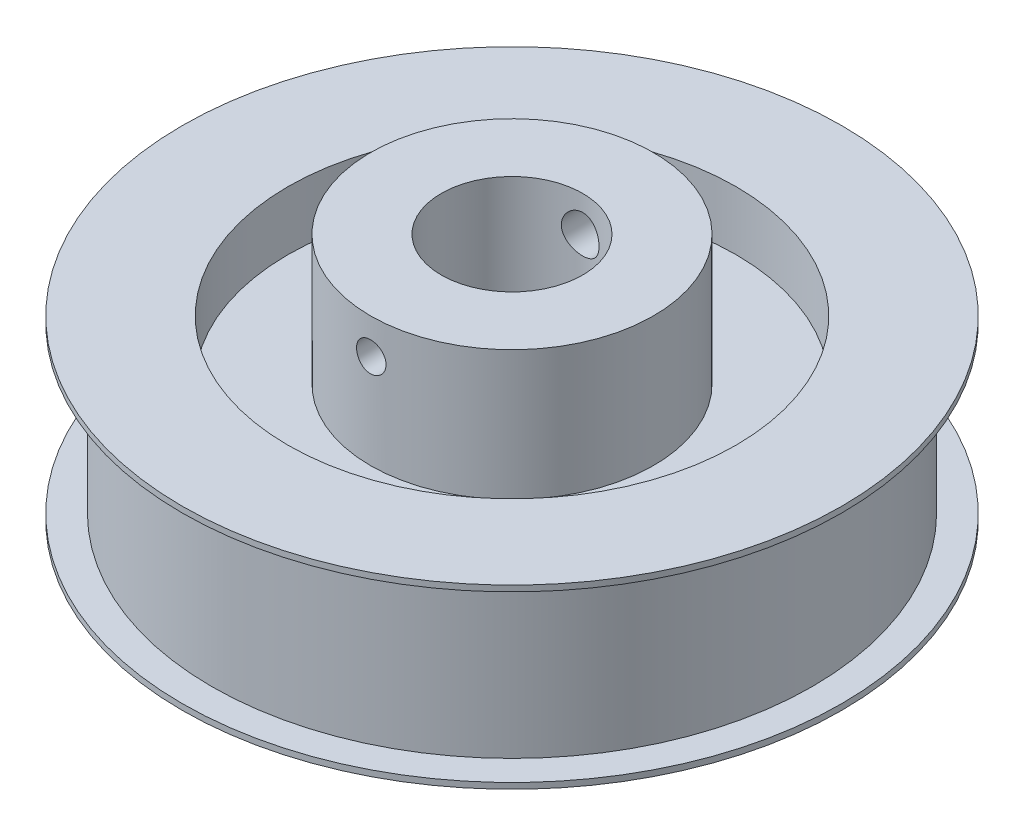
from build123d import *

# Parameters (mm, degrees)
CROQUIS1_R                                     = 25.465
SALIENTE_EXTRUIR1_DEPTH                        = 7.5
CROQUIS2_R                                     = 27.965
SALIENTE_EXTRUIR2_DEPTH                        = 0.5
SALIENTE_EXTRUIR3_START                        = -14.5
CROQUIS2_2_R                                   = 27.965
SALIENTE_EXTRUIR3_DEPTH                        = 0.5
CROQUIS3_R                                     = 19
SALIENTE_EXTRUIR4_DEPTH                        = 21
CORTAR_EXTRUIR1_DEPTH                          = 45.545846608
CORTAR_EXTRUIR1_DEPTH_BACK                     = 45.545846608
CROQUIS4_R                                     = 6
CORTAR_EXTRUIR2_START                          = -11
CROQUIS5_R                                     = 19
CROQUIS5_R_2                                   = 12
CORTAR_EXTRUIR2_DEPTH                          = 11
PERFORADOR_PARA_ROSCAR_PARA_MACHO_DE_ROS_REACH = 60.109
PERFORADOR_PARA_ROSCAR_PARA_MACHO_DE_2_R       = 1.25
TALADRO_DE_MARGEN_PARA_M32_REACH               = 52.611
TALADRO_DE_MARGEN_PARA_M32_BORE_R              = 1.6


with BuildPart() as part:
    # Croquis1 → Saliente-Extruir1 (new, symmetric)
    with BuildSketch(Plane(origin=(0, 0, 0), x_dir=(-1, 0, 0), z_dir=(0, 1, 0))):
        with Locations(Location((0, 0, 0), (0, 0, 90))):
            Circle(CROQUIS1_R)
    extrude(amount=SALIENTE_EXTRUIR1_DEPTH, both=True)

    # Croquis2 → Saliente-Extruir2 (add)
    with BuildSketch(Plane(origin=(0, 7.5, 0), x_dir=(-1, 0, 0), z_dir=(0, 1, 0))):
        with Locations(Location((0, 0, 0), (0, 0, 90))):
            Circle(CROQUIS2_R)
    extrude(amount=-SALIENTE_EXTRUIR2_DEPTH)

    # Croquis2<2> → Saliente-Extruir3 (add)
    with BuildSketch(Plane(origin=(0, 7.5, 0), x_dir=(-1, 0, 0), z_dir=(0, 1, 0)).offset(SALIENTE_EXTRUIR3_START)):
        with Locations(Location((0, 0, 0), (0, 0, 90))):
            Circle(CROQUIS2_2_R)
    extrude(amount=-SALIENTE_EXTRUIR3_DEPTH)

    # Croquis3 → Saliente-Extruir4 (add)
    with BuildSketch(Plane(origin=(0, -7.5, 0), x_dir=(-1, 0, 0), z_dir=(0, 1, 0))):
        with Locations(Location((0, 0, 0), (0, 0, 270))):
            Circle(CROQUIS3_R)
    extrude(amount=SALIENTE_EXTRUIR4_DEPTH)

    # Croquis4 → Cortar-Extruir1 (cut, two sides: drawn at the far end of the back side and taken through both)
    with BuildSketch(Plane(origin=(0, -7, 0), x_dir=(-1, 0, 0), z_dir=(0, 1, 0)).offset(-CORTAR_EXTRUIR1_DEPTH_BACK)):
        with Locations(Location((0, 0, 0), (0, 0, 90))):
            Circle(CROQUIS4_R)
    extrude(amount=CORTAR_EXTRUIR1_DEPTH + CORTAR_EXTRUIR1_DEPTH_BACK, mode=Mode.SUBTRACT)

    # Croquis5 → Cortar-Extruir2 (cut)
    with BuildSketch(Plane(origin=(0, 13.5, 0), x_dir=(-1, 0, 0), z_dir=(0, 1, 0)).offset(CORTAR_EXTRUIR2_START)):
        with Locations(Location((0, 0, 0), (0, 0, 90))):
            Circle(CROQUIS5_R)
        with Locations(Location((0, 0, 0), (0, 0, 90))):
            Circle(CROQUIS5_R_2, mode=Mode.SUBTRACT)
    extrude(amount=CORTAR_EXTRUIR2_DEPTH, mode=Mode.SUBTRACT)

    # Perforador para roscar para macho de 2 → Perforador para roscar para macho de roscar para M31 (cut, up to next)
    with BuildSketch(Plane(origin=(-12, 0, 12), x_dir=(0, 1, 0), z_dir=(0, 0, 1)), mode=Mode.PRIVATE) as perforador_para_roscar_para_macho_de_ros_sk1:
        with Locations((10.5, -12)):
            Circle(PERFORADOR_PARA_ROSCAR_PARA_MACHO_DE_2_R)
    perforador_para_roscar_para_macho_de_ros_tool1 = extrude(perforador_para_roscar_para_macho_de_ros_sk1.sketch, amount=-PERFORADOR_PARA_ROSCAR_PARA_MACHO_DE_ROS_REACH, mode=Mode.PRIVATE) & part.part
    add(perforador_para_roscar_para_macho_de_ros_tool1.solids().sort_by_distance((0, 10.5, 12))[0], mode=Mode.SUBTRACT)

    # Taladro de margen para M32 bore → Taladro de margen para M32 (cut, up to next)
    with BuildSketch(Plane(origin=(0, 0, -12), x_dir=(-1, 0, 0), z_dir=(0, 0, -1)), mode=Mode.PRIVATE) as taladro_de_margen_para_m32_sk1:
        with Locations((0, 10.5)):
            Circle(TALADRO_DE_MARGEN_PARA_M32_BORE_R)
    taladro_de_margen_para_m32_tool1 = extrude(taladro_de_margen_para_m32_sk1.sketch, amount=-TALADRO_DE_MARGEN_PARA_M32_REACH, mode=Mode.PRIVATE) & part.part
    add(taladro_de_margen_para_m32_tool1.solids().sort_by_distance((0, 10.5, -12))[0], mode=Mode.SUBTRACT)


solid = part.part
